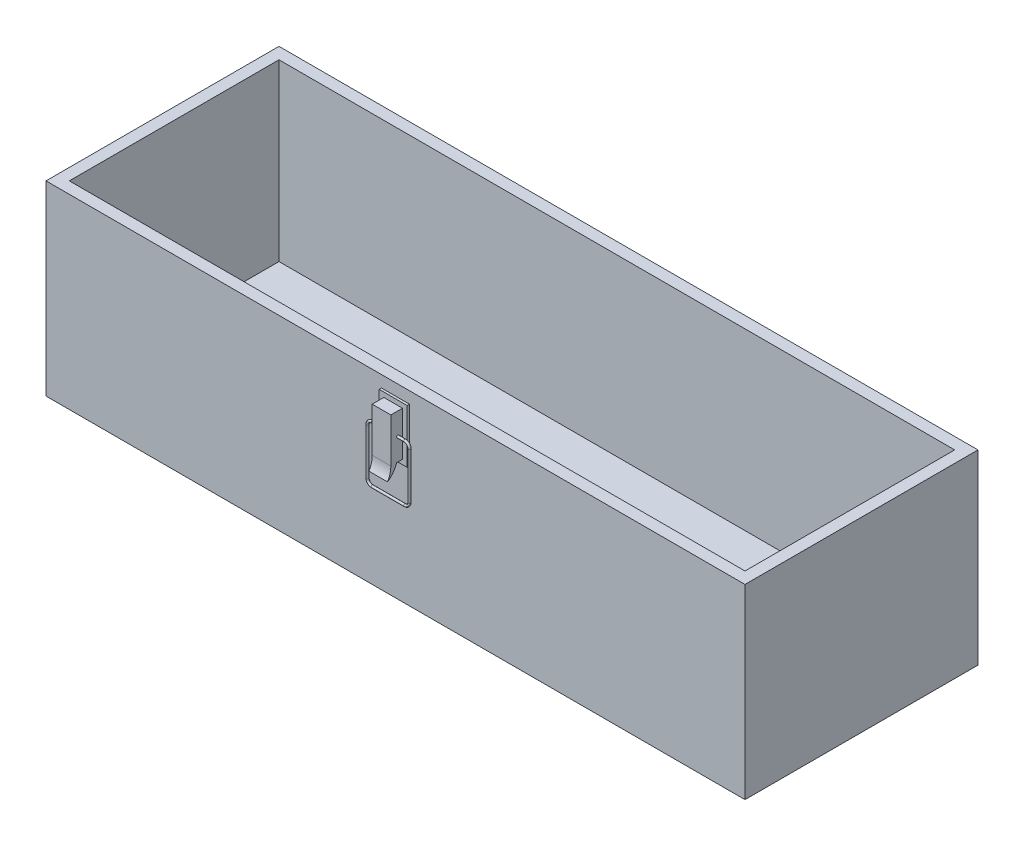
from build123d import *

# Parameters (mm, degrees)
SKETCH1_W           = 300
SKETCH1_H           = 100
BOSS_EXTRUDE1_DEPTH = 80
SHELL1_T            = -5
SKETCH2_W           = 12
SKETCH2_H           = 23
BOSS_EXTRUDE2_DEPTH = 1
SKETCH3_W           = 8
SKETCH3_H           = 19
BOSS_EXTRUDE3_DEPTH = 5
BOSS_EXTRUDE4_DEPTH = 8
SKETCH6_R           = 0.5


with BuildPart() as part:
    # Sketch1 → Boss-Extrude1 (new body)
    with BuildSketch(Plane(origin=(0, 0, 0), x_dir=(1, 0, 0), z_dir=(0, 1, 0))):
        Rectangle(SKETCH1_W, SKETCH1_H)
    extrude(amount=BOSS_EXTRUDE1_DEPTH)

    # Shell1
    shell1_openings = [part.faces().sort_by_distance(p)[0] for p in [
        (0, 80, 0),
    ]]
    offset(amount=SHELL1_T, openings=shell1_openings, kind=Kind.INTERSECTION)

    # Sketch2 → Boss-Extrude2 (add)
    with BuildSketch(Plane.XY.offset(50)):
        with Locations((0, 63.5)):
            Rectangle(SKETCH2_W, SKETCH2_H)
    extrude(amount=BOSS_EXTRUDE2_DEPTH)

    # Sketch3 → Boss-Extrude3 (add)
    with BuildSketch(Plane.XY.offset(51)):
        with Locations((0, 63.5)):
            Rectangle(SKETCH3_W, SKETCH3_H)
    extrude(amount=BOSS_EXTRUDE3_DEPTH)

    # Sketch4 → Boss-Extrude4 (add)
    with BuildSketch(Plane(origin=(4, 0, 0), x_dir=(0, 0, -1), z_dir=(1, 0, 0))):
        with BuildLine():
            Line((-56, 54), (-53.5, 54))
            ThreePointArc((-53.5, 54), (-55.03079013, 51.083775539), (-57.395060139, 48.790762051))
            ThreePointArc((-57.395060139, 48.790762051), (-56.354803681, 51.303597174), (-56, 54))
        make_face()
    extrude(amount=-BOSS_EXTRUDE4_DEPTH)

    # Sweep1: sweep along a path in Sketch5
    with BuildLine(Plane.XY.offset(53)) as sweep1_path:
        Line((-4, 63.5), (-7, 63.5))
        ThreePointArc((-7, 63.5), (-8.414213562, 62.914213562), (-9, 61.5))
        Line((-9, 61.5), (-9, 41.5))
        ThreePointArc((-9, 41.5), (-8.414213562, 40.085786438), (-7, 39.5))
        Line((-7, 39.5), (7, 39.5))
        ThreePointArc((7, 39.5), (8.414213562, 40.085786438), (9, 41.5))
        Line((9, 41.5), (9, 61.5))
        ThreePointArc((9, 61.5), (8.414213562, 62.914213562), (7, 63.5))
        Line((7, 63.5), (4, 63.5))
    # Sketch6 → Sweep1 (sweep)
    with BuildSketch(Plane.ZY.offset(4)):
        with Locations((53, 63.5)):
            Circle(SKETCH6_R)
    sweep(path=sweep1_path.line)


solid = part.part
